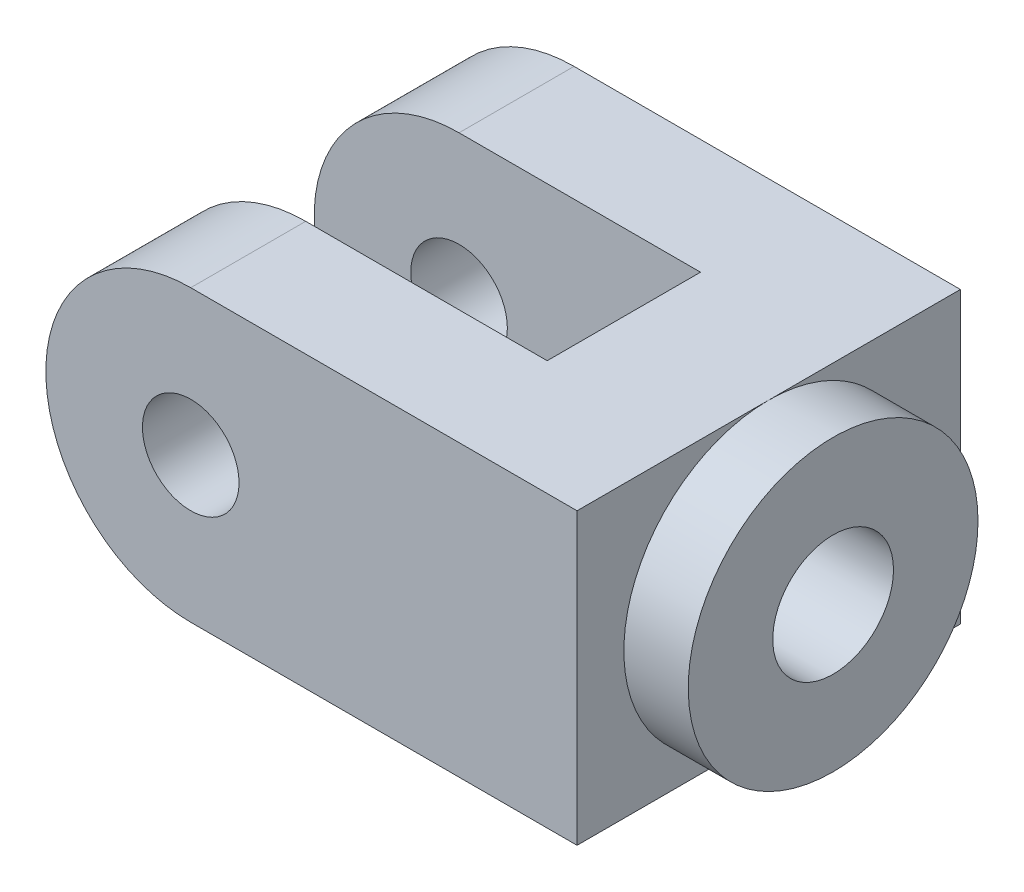
from build123d import *

# Parameters (mm, degrees)
SKETCH1_W               = 132
SKETCH1_H               = 72
BOSS_EXTRUDE1_DEPTH     = 47.625
CUT_EXTRUDE1_DEPTH      = 122.344808294
CUT_EXTRUDE1_DEPTH_BACK = 122.344808294
SKETCH3_W               = 96
SKETCH3_H               = 38.1
CUT_EXTRUDE2_DEPTH      = 109.665268715
SKETCH4_R               = 15
CUT_EXTRUDE3_DEPTH      = 145.872842952
BOSS_EXTRUDE2_START     = 16
SKETCH5_R               = 36
SKETCH5_R_2             = 15
BOSS_EXTRUDE2_DEPTH     = 16
SKETCH6_R               = 12
CUT_EXTRUDE4_DEPTH      = 131.738527221


with BuildPart() as part:
    # Sketch1 → Boss-Extrude1 (new, symmetric)
    with BuildSketch(Plane.XY):
        Rectangle(SKETCH1_W, SKETCH1_H)
    extrude(amount=BOSS_EXTRUDE1_DEPTH, both=True)

    # Sketch2 → Cut-Extrude1 (cut, two sides: drawn at the far end of the back side and taken through both)
    with BuildSketch(Plane.XY.offset(47.625).offset(-CUT_EXTRUDE1_DEPTH_BACK)):
        with BuildLine():
            Line((220.000003236, 36), (-30, 36))
            ThreePointArc((-30, 36), (-66, 1.011e-06), (-30.000002023, -36))
            Line((-30.000002023, -36), (220.000001214, -36.000014046))
            Line((220.000001214, -36.000014046), (-280.000005259, -36))
            Line((-280.000005259, -36), (-280.000003236, 36.000014046))
            Line((-280.000003236, 36.000014046), (220.000003236, 36))
        make_face()
    extrude(amount=CUT_EXTRUDE1_DEPTH + CUT_EXTRUDE1_DEPTH_BACK, mode=Mode.SUBTRACT)

    # Sketch3 → Cut-Extrude2 (cut, through all)
    with BuildSketch(Plane(origin=(0, 36, 0), x_dir=(1, 0, 0), z_dir=(0, 1, 0))):
        with Locations((-18, 0)):
            Rectangle(SKETCH3_W, SKETCH3_H)
    extrude(amount=-CUT_EXTRUDE2_DEPTH, mode=Mode.SUBTRACT)

    # Sketch4 → Cut-Extrude3 (cut, through all)
    with BuildSketch(Plane(origin=(66, 0, 0), x_dir=(0, 0, -1), z_dir=(1, 0, 0))):
        Circle(SKETCH4_R)
    extrude(amount=-CUT_EXTRUDE3_DEPTH, mode=Mode.SUBTRACT)

    # Sketch5 → Boss-Extrude2 (add)
    with BuildSketch(Plane(origin=(66, 0, 0), x_dir=(0, 0, -1), z_dir=(1, 0, 0)).offset(BOSS_EXTRUDE2_START)):
        with Locations(Location((0, 0, 0), (0, 0, 270))):
            Circle(SKETCH5_R)
        Circle(SKETCH5_R_2, mode=Mode.SUBTRACT)
    extrude(amount=-BOSS_EXTRUDE2_DEPTH)

    # Sketch6 → Cut-Extrude4 (cut, through all)
    with BuildSketch(Plane.XY.offset(47.625)):
        with Locations((-30, 0)):
            Circle(SKETCH6_R)
    extrude(amount=-CUT_EXTRUDE4_DEPTH, mode=Mode.SUBTRACT)


solid = part.part
